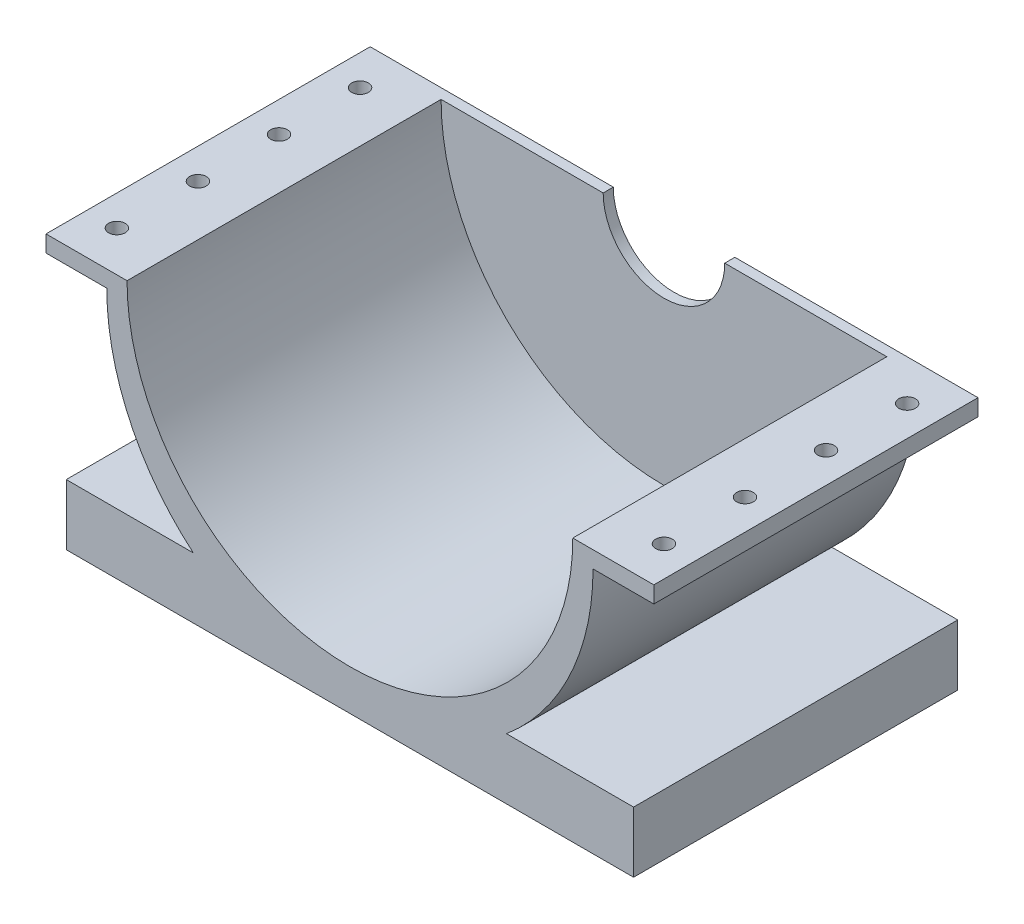
from build123d import *

# Parameters (mm, degrees)
BOSS_EXTRUDE1_DEPTH = 4
CUT_EXTRUDE1_DEPTH  = 7.75
CUT_EXTRUDE2_DEPTH  = 7.75
SKETCH4_R           = 0.205
CUT_EXTRUDE3_DEPTH  = 2.75


with BuildPart() as part:
    # Sketch1 → Boss-Extrude1 (new, symmetric)
    with BuildSketch(Plane.XY):
        with BuildLine():
            Line((7.5, 0), (6, 0))
            ThreePointArc((6, 0), (5.439903034, -2.531295119), (3.864181673, -4.59))
            Line((3.864181673, -4.59), (7, -4.59))
            Line((7, -4.59), (7, -6.09))
            Line((7, -6.09), (-7, -6.09))
            Line((-7, -6.09), (-7, -4.59))
            Line((-7, -4.59), (-3.864181673, -4.59))
            ThreePointArc((-3.864181673, -4.59), (-5.439903034, -2.531295119), (-6, 0))
            Line((-6, 0), (-7.5, 0))
            Line((-7.5, 0), (-7.5, 0.41))
            Line((-7.5, 0.41), (7.5, 0.41))
            Line((7.5, 0.41), (7.5, 0))
        make_face()
    extrude(amount=BOSS_EXTRUDE1_DEPTH, both=True)

    # Sketch2 → Cut-Extrude1 (cut)
    with BuildSketch(Plane.XY.offset(4)):
        with BuildLine():
            Line((-5.5, 0.41), (5.5, 0.41))
            ThreePointArc((5.5, 0.41), (0, -5.09), (-5.5, 0.41))
        make_face()
    extrude(amount=-CUT_EXTRUDE1_DEPTH, mode=Mode.SUBTRACT)

    # Sketch3 → Cut-Extrude2 (cut)
    with BuildSketch(Plane(origin=(0, 0, -4), x_dir=(-1, 0, 0), z_dir=(0, 0, -1))):
        with BuildLine():
            Line((-1.5, 0.41), (1.5, 0.41))
            ThreePointArc((1.5, 0.41), (0, -1.09), (-1.5, 0.41))
        make_face()
    extrude(amount=-CUT_EXTRUDE2_DEPTH, mode=Mode.SUBTRACT)

    # Sketch4 → Cut-Extrude3 (cut)
    with BuildSketch(Plane(origin=(0, 0.41, 0), x_dir=(1, 0, 0), z_dir=(0, 1, 0))):
        with Locations(Location((6.75, 3, 0), (0, 0, 180))):
            Circle(SKETCH4_R)
        with Locations(Location((6.75, 1, 0), (0, 0, 180))):
            Circle(SKETCH4_R)
        with Locations(Location((6.75, -1, 0), (0, 0, 180))):
            Circle(SKETCH4_R)
        with Locations(Location((6.75, -3, 0), (0, 0, 180))):
            Circle(SKETCH4_R)
    cut_extrude3 = extrude(amount=-CUT_EXTRUDE3_DEPTH, mode=Mode.SUBTRACT)

    # Mirror1: Cut-Extrude3 across plane
    add(cut_extrude3.mirror(Plane(origin=(0, 0, 0), x_dir=(0, 0, 1), z_dir=(1, 0, 0))), mode=Mode.SUBTRACT)


solid = part.part
